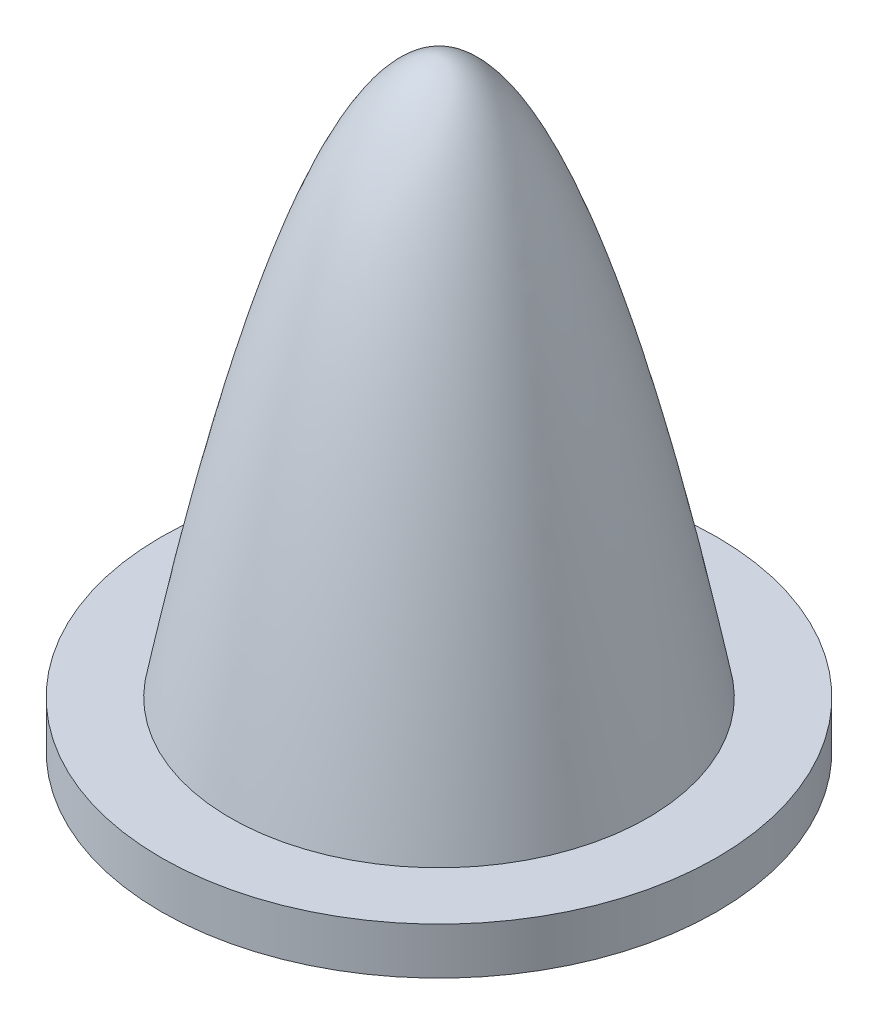
from build123d import *

# Parameters (mm, degrees)
F_10_24_TAPPED_HOLE1_D     = 3.7973
F_10_24_TAPPED_HOLE1_DEPTH = 8.5
F_10_24_TAPPED_HOLE1_TIP   = 1.140824014


with BuildPart() as part:
    # Sketch1 → Revolve1 (revolve)
    with BuildSketch(Plane.XY, mode=Mode.PRIVATE) as revolve1_sk:
        with BuildLine():
            Line((0, 0), (0, 12.87))
            add(Edge.make_bspline(
                [(0, 12.87), (-2.244176977, 12.783834699), (-4.465, 1)],
                knots=[0, 0, 0, 1, 1, 1], degree=2))
            Line((-4.465, 1), (-5.94, 1))
            Line((-5.94, 1), (-5.94, 0))
            Line((-5.94, 0), (0, 0))
        make_face()
    revolve(revolve1_sk.sketch.rotate(Axis((0, 0, 0), (0, 1, 0)), 270), axis=Axis((0, 0, 0), (0, 1, 0)))

    # #10-24 Tapped Hole1
    with Locations(Plane(origin=(0, 0, 0), x_dir=(-1, 0, 0), z_dir=(0, -1, 0))):
        with Locations((0, 0)):
            Hole(F_10_24_TAPPED_HOLE1_D / 2, depth=F_10_24_TAPPED_HOLE1_DEPTH)
            with Locations((0, 0, -(F_10_24_TAPPED_HOLE1_DEPTH + F_10_24_TAPPED_HOLE1_TIP / 2))):  # 118° drill point
                Cone(0, F_10_24_TAPPED_HOLE1_D / 2, F_10_24_TAPPED_HOLE1_TIP, mode=Mode.SUBTRACT)


solid = part.part
